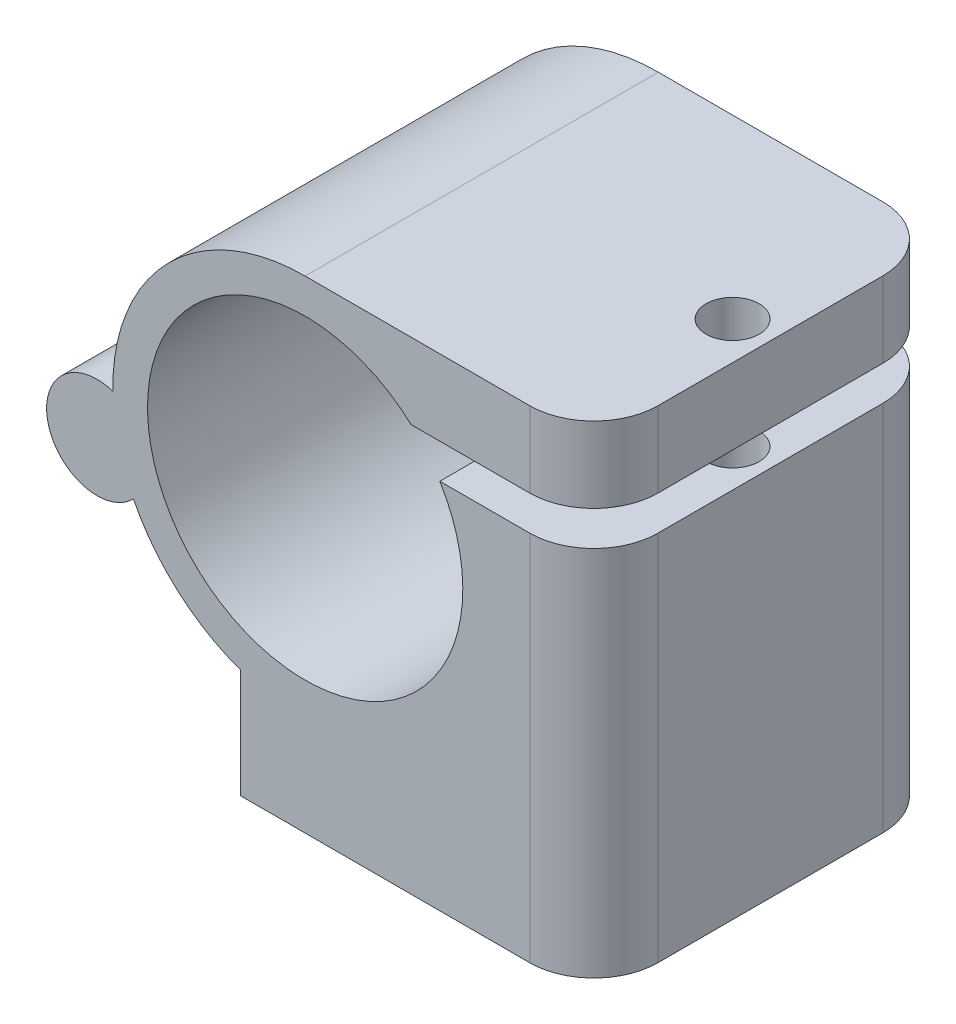
from build123d import *

# Parameters (mm, degrees)
SKETCH1_W           = 28
SKETCH1_H           = 28
BOSS_EXTRUDE1_DEPTH = 10.5
BOSS_EXTRUDE3_DEPTH = 28
SKETCH3_R           = 4
BOSS_EXTRUDE4_DEPTH = 28
BOSS_EXTRUDE5_START = -28
BOSS_EXTRUDE5_DEPTH = 28
CUT_EXTRUDE1_DEPTH  = 56.774700458
BOSS_EXTRUDE6_START = -28
BOSS_EXTRUDE6_DEPTH = 28
SKETCH8_R           = 2.1
CUT_EXTRUDE2_DEPTH  = 12.75
SKETCH1_4_R         = 1.524
SKETCH1_4_R_2       = 1.0795
CUT_EXTRUDE3_DEPTH  = 5.2
SKETCH1_5_R         = 2.54
CUT_EXTRUDE4_DEPTH  = 9.5
SKETCH1_6_R         = 4.7625
CUT_EXTRUDE5_DEPTH  = 14.5
FILLET1_R           = 5.08
FILLET2_R           = 5.08
FILLET3_R           = 5.08
FILLET4_R           = 5.08


with BuildPart() as part:
    # Sketch1 → Boss-Extrude1 (new body)
    with BuildSketch(Plane(origin=(0, 0, 0), x_dir=(1, 0, 0), z_dir=(0, 1, 0))):
        Rectangle(SKETCH1_W, SKETCH1_H)
    extrude(amount=BOSS_EXTRUDE1_DEPTH)

    # Sketch2 → Boss-Extrude3 (add)
    with BuildSketch(Plane(origin=(0, 0, -14), x_dir=(-1, 0, 0), z_dir=(0, 0, -1))):
        with BuildLine():
            ThreePointArc((21.39, 23), (17.728834765, 14.161165235), (8.89, 10.5))
            Line((8.89, 10.5), (14, 10.5))
            Line((14, 10.5), (14, 8.631618045))
            ThreePointArc((14, 8.631618045), (21.34973515, 14.206962982), (24.14, 23))
            Line((24.14, 23), (21.39, 23))
        make_face()
        with BuildLine():
            Line((8.89, 10.5), (8.89, 7.75))
            ThreePointArc((8.89, 7.75), (11.482747113, 7.972020681), (14, 8.631618045))
            Line((14, 8.631618045), (14, 10.5))
            Line((14, 10.5), (8.89, 10.5))
        make_face()
        with BuildLine():
            Line((0.154297395, 10.5), (8.89, 10.5))
            ThreePointArc((8.89, 10.5), (0.051165235, 14.161165235), (-3.61, 23))
            Line((-3.61, 23), (-6.36, 23))
            ThreePointArc((-6.36, 23), (-4.63371925, 15.952197673), (0.154297395, 10.5))
        make_face()
        with BuildLine():
            ThreePointArc((0.154297395, 10.5), (4.310835229, 8.453737593), (8.89, 7.75))
            Line((8.89, 7.75), (8.89, 10.5))
            Line((8.89, 10.5), (0.154297395, 10.5))
        make_face()
        with BuildLine():
            ThreePointArc((8.89, 35.5), (17.728834765, 31.838834765), (21.39, 23))
            Line((21.39, 23), (24.14, 23))
            ThreePointArc((24.14, 23), (19.673378413, 33.783378413), (8.89, 38.25))
            Line((8.89, 38.25), (8.89, 35.5))
        make_face()
        with BuildLine():
            Line((-6.36, 23), (-3.61, 23))
            ThreePointArc((-3.61, 23), (0.051165235, 31.838834765), (8.89, 35.5))
            Line((8.89, 35.5), (8.89, 38.25))
            ThreePointArc((8.89, 38.25), (-1.893378413, 33.783378413), (-6.36, 23))
        make_face()
    extrude(amount=-BOSS_EXTRUDE3_DEPTH)

    # Sketch3 → Boss-Extrude4 (add)
    with BuildSketch(Plane.XY.offset(14)):
        with Locations((-25.389704171, 18.914002035)):
            Circle(SKETCH3_R)
    extrude(amount=-BOSS_EXTRUDE4_DEPTH)

    # Sketch5 → Boss-Extrude5 (add)
    with BuildSketch(Plane.XY.offset(14).offset(BOSS_EXTRUDE5_START)):
        with BuildLine():
            ThreePointArc((4.905379661, 29.5), (5.846431624, 19.075706053), (-0.154297395, 10.5))
            Line((-0.154297395, 10.5), (14, 10.5))
            Line((14, 10.5), (14, 29.5))
            Line((14, 29.5), (4.905379661, 29.5))
        make_face()
    extrude(amount=BOSS_EXTRUDE5_DEPTH)

    # Sketch6 → Cut-Extrude1 (cut, through all)
    with BuildSketch(Plane.XY.offset(14)):
        with BuildLine():
            Line((14, 29.5), (14, 32.25))
            Line((14, 32.25), (-0.48241414, 32.25))
            ThreePointArc((-0.48241414, 32.25), (0.750888241, 30.956335459), (1.787078252, 29.5))
            Line((1.787078252, 29.5), (14, 29.5))
        make_face()
    extrude(amount=-CUT_EXTRUDE1_DEPTH, mode=Mode.SUBTRACT)

    # Sketch7 → Boss-Extrude6 (add)
    with BuildSketch(Plane.XY.offset(14).offset(BOSS_EXTRUDE6_START)):
        with BuildLine():
            Line((14, 38.25), (-8.89, 38.25))
            ThreePointArc((-8.89, 38.25), (-3.444771469, 37.244717837), (1.282556587, 34.361408032))
            Line((1.282556587, 34.361408032), (6.806, 32.25))
            Line((6.806, 32.25), (14, 32.25))
            Line((14, 32.25), (14, 38.25))
        make_face()
        with BuildLine():
            Line((6.806, 32.25), (1.282556587, 34.361408032))
            ThreePointArc((1.282556587, 34.361408032), (2.308329555, 33.351807338), (3.234355653, 32.25))
            Line((3.234355653, 32.25), (6.806, 32.25))
        make_face()
    extrude(amount=BOSS_EXTRUDE6_DEPTH)

    # Sketch8 → Cut-Extrude2 (cut)
    with BuildSketch(Plane(origin=(0, 38.25, 0), x_dir=(1, 0, 0), z_dir=(0, 1, 0))):
        with Locations(Location((11, 0, 0), (0, 0, 270))):
            Circle(SKETCH8_R)
    extrude(amount=-CUT_EXTRUDE2_DEPTH, mode=Mode.SUBTRACT)

    # Sketch1<4> → Cut-Extrude3 (cut)
    with BuildSketch(Plane(origin=(0, 0, 0), x_dir=(1, 0, 0), z_dir=(0, 1, 0))):
        with Locations(Location((-8.92, 8.92, 0), (0, 0, 270))):
            Circle(SKETCH1_4_R)
        with Locations(Location((8.92, 8.92, 0), (0, 0, 270))):
            Circle(SKETCH1_4_R)
        with Locations(Location((8.92, -8.92, 0), (0, 0, 270))):
            Circle(SKETCH1_4_R)
        with Locations(Location((-8.92, -8.92, 0), (0, 0, 270))):
            Circle(SKETCH1_4_R)
        with Locations(Location((-8.92, 0, 0), (0, 0, 270))):
            Circle(SKETCH1_4_R_2)
    extrude(amount=CUT_EXTRUDE3_DEPTH, mode=Mode.SUBTRACT)

    # Sketch1<5> → Cut-Extrude4 (cut)
    with BuildSketch(Plane(origin=(0, 0, 0), x_dir=(1, 0, 0), z_dir=(0, 1, 0))):
        with Locations(Location((0, 8.92, 0), (0, 0, 270))):
            Circle(SKETCH1_5_R)
        with Locations(Location((0, -8.92, 0), (0, 0, 270))):
            Circle(SKETCH1_5_R)
        with Locations(Location((0, 0, 0), (0, 0, 270))):
            Circle(SKETCH1_5_R)
    extrude(amount=CUT_EXTRUDE4_DEPTH, mode=Mode.SUBTRACT)

    # Sketch1<6> → Cut-Extrude5 (cut)
    with BuildSketch(Plane(origin=(0, 0, 0), x_dir=(1, 0, 0), z_dir=(0, 1, 0))):
        with Locations(Location((8.92, 0, 0), (0, 0, 90))):
            Circle(SKETCH1_6_R)
    extrude(amount=CUT_EXTRUDE5_DEPTH, mode=Mode.SUBTRACT)

    # Fillet1
    fillet1_edges = [part.edges().sort_by_distance(p)[0] for p in [
        (14, 14.75, 14),
    ]]
    fillet(fillet1_edges, radius=FILLET1_R)

    # Fillet2
    fillet2_edges = [part.edges().sort_by_distance(p)[0] for p in [
        (14, 35.25, 14),
    ]]
    fillet(fillet2_edges, radius=FILLET2_R)

    # Fillet3
    fillet3_edges = [part.edges().sort_by_distance(p)[0] for p in [
        (14, 35.25, -14),
    ]]
    fillet(fillet3_edges, radius=FILLET3_R)

    # Fillet4
    fillet4_edges = [part.edges().sort_by_distance(p)[0] for p in [
        (14, 14.75, -14),
    ]]
    fillet(fillet4_edges, radius=FILLET4_R)


solid = part.part
